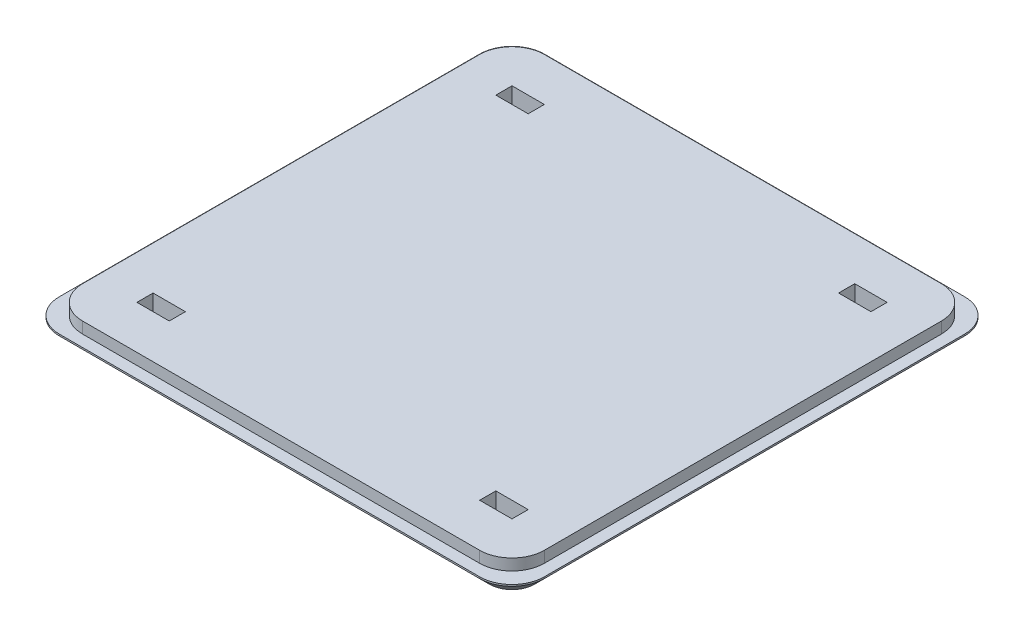
from build123d import *

# Parameters (mm, degrees)
SKETCH1_W           = 150
SKETCH1_H           = 150
BOSS_EXTRUDE1_DEPTH = 3.5
SKETCH2_W           = 142.8
SKETCH2_H           = 142.8
BOSS_EXTRUDE2_DEPTH = 3.5
FILLET9_R           = 10
FILLET10_R          = 10
CHAMFER3_SIZE       = 3
SKETCH3_W           = 10
SKETCH3_H           = 5
CUT_EXTRUDE1_DEPTH  = 10
SKETCH4_W           = 10
SKETCH4_H           = 5
CUT_EXTRUDE2_DEPTH  = 10
SKETCH5_W           = 10
SKETCH5_H           = 5
CUT_EXTRUDE3_DEPTH  = 10
SKETCH6_W           = 10
SKETCH6_H           = 5
CUT_EXTRUDE4_DEPTH  = 10


with BuildPart() as part:
    # Sketch1 → Boss-Extrude1 (new body)
    with BuildSketch(Plane(origin=(0, 0, 0), x_dir=(1, 0, 0), z_dir=(0, 1, 0))):
        with Locations((75, 75)):
            Rectangle(SKETCH1_W, SKETCH1_H)
    extrude(amount=BOSS_EXTRUDE1_DEPTH)

    # Sketch2 → Boss-Extrude2 (add)
    with BuildSketch(Plane(origin=(0, 3.5, 0), x_dir=(1, 0, 0), z_dir=(0, 1, 0))):
        with Locations((75, 75)):
            Rectangle(SKETCH2_W, SKETCH2_H)
    extrude(amount=BOSS_EXTRUDE2_DEPTH)

    # Fillet9
    fillet9_edges = [part.edges().sort_by_distance(p)[0] for p in [
        (146.4, 5.25, -3.6),
        (150, 1.75, 0),
    ]]
    fillet(fillet9_edges, radius=FILLET9_R)

    # Fillet10
    fillet10_edges = [part.edges().sort_by_distance(p)[0] for p in [
        (3.6, 5.25, -146.4),
        (3.6, 5.25, -3.6),
        (146.4, 5.25, -146.4),
        (0, 1.75, -150),
        (150, 1.75, -150),
        (0, 1.75, 0),
    ]]
    fillet(fillet10_edges, radius=FILLET10_R)

    # Chamfer3
    chamfer3_edges = [part.edges().sort_by_distance(p)[0] for p in [
        (150, 0, -75),
        (147.071067812, 0, -2.928932188),
        (0, 0, -75),
        (75, 0, 0),
        (75, 0, -150),
        (147.071067812, 0, -147.071067812),
        (2.928932188, 0, -2.928932188),
        (2.928932188, 0, -147.071067812),
    ]]
    chamfer(chamfer3_edges, length=CHAMFER3_SIZE)

    # Sketch3 → Cut-Extrude1 (cut)
    with BuildSketch(Plane(origin=(0, 7, 0), x_dir=(1, 0, 0), z_dir=(0, 1, 0))):
        with Locations((22, 19.5)):
            Rectangle(SKETCH3_W, SKETCH3_H)
    extrude(amount=-CUT_EXTRUDE1_DEPTH, mode=Mode.SUBTRACT)

    # Sketch4 → Cut-Extrude2 (cut)
    with BuildSketch(Plane(origin=(0, 7, 0), x_dir=(1, 0, 0), z_dir=(0, 1, 0))):
        with Locations((22, 130.5)):
            Rectangle(SKETCH4_W, SKETCH4_H)
    extrude(amount=-CUT_EXTRUDE2_DEPTH, mode=Mode.SUBTRACT)

    # Sketch5 → Cut-Extrude3 (cut)
    with BuildSketch(Plane(origin=(0, 7, 0), x_dir=(1, 0, 0), z_dir=(0, 1, 0))):
        with Locations((128, 19.5)):
            Rectangle(SKETCH5_W, SKETCH5_H)
    extrude(amount=-CUT_EXTRUDE3_DEPTH, mode=Mode.SUBTRACT)

    # Sketch6 → Cut-Extrude4 (cut)
    with BuildSketch(Plane(origin=(0, 7, 0), x_dir=(1, 0, 0), z_dir=(0, 1, 0))):
        with Locations((128, 130.5)):
            Rectangle(SKETCH6_W, SKETCH6_H)
    extrude(amount=-CUT_EXTRUDE4_DEPTH, mode=Mode.SUBTRACT)


solid = part.part
